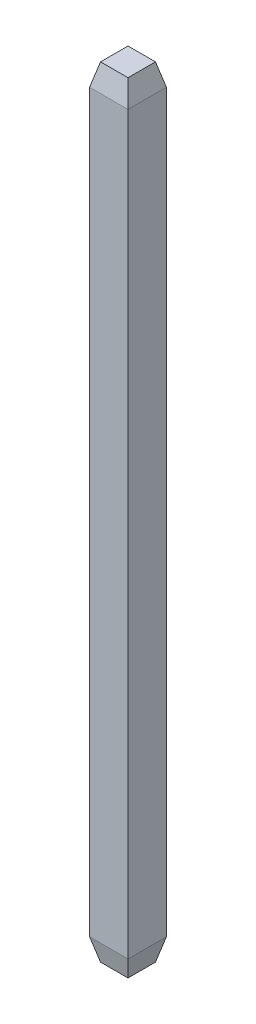
from build123d import *
from OCP.BRepFilletAPI import BRepFilletAPI_MakeChamfer

# Parameters (mm, degrees)
SKETCH_1_W      = 0.7
SKETCH_1_H      = 0.7
EXTRUDE_1_DEPTH = 14.2
CHAMFER_1_SIZE  = 0.4
CHAMFER_1_SIZE2 = 0.1
CHAMFER_2_SIZE  = 0.1
CHAMFER_2_SIZE2 = 0.4


with BuildPart() as part:
    # Эскиз1 → Бобышка-Вытянуть1 (new body)
    with BuildSketch(Plane(origin=(0, 0, 0), x_dir=(1, 0, 0), z_dir=(0, 1, 0))):
        Rectangle(SKETCH_1_W, SKETCH_1_H)
    extrude(amount=EXTRUDE_1_DEPTH)

    # Фаска1: one chamfer whose edges measure the first distance from different faces: ONE call of the kernel's chamfer builder (chamfer() names one face for all edges)
    chamfer_1_edges_1 = [part.edges().sort_by_distance(p)[0] for p in [
        (0, 14.2, -0.35),
    ]]
    chamfer_1_side_1 = [part.faces().sort_by_distance(p)[0] for p in [
        (0, 7.1, -0.35),
    ]]
    chamfer_1_edges_2 = [part.edges().sort_by_distance(p)[0] for p in [
        (-0.35, 14.2, 0),
    ]]
    chamfer_1_side_2 = [part.faces().sort_by_distance(p)[0] for p in [
        (-0.35, 7.1, 0),
    ]]
    chamfer_1_edges_3 = [part.edges().sort_by_distance(p)[0] for p in [
        (0, 14.2, 0.35),
    ]]
    chamfer_1_side_3 = [part.faces().sort_by_distance(p)[0] for p in [
        (0, 7.1, 0.35),
    ]]
    chamfer_1_edges_4 = [part.edges().sort_by_distance(p)[0] for p in [
        (0.35, 14.2, 0),
    ]]
    chamfer_1_side_4 = [part.faces().sort_by_distance(p)[0] for p in [
        (0.35, 7.1, 0),
    ]]
    chamfer_1 = BRepFilletAPI_MakeChamfer(part.part.solid().wrapped)
    for e in chamfer_1_edges_1:
        chamfer_1.Add(CHAMFER_1_SIZE, CHAMFER_1_SIZE2, e.wrapped, chamfer_1_side_1[0].wrapped)  # the first distance lies on this face
    for e in chamfer_1_edges_2:
        chamfer_1.Add(CHAMFER_1_SIZE, CHAMFER_1_SIZE2, e.wrapped, chamfer_1_side_2[0].wrapped)  # the first distance lies on this face
    for e in chamfer_1_edges_3:
        chamfer_1.Add(CHAMFER_1_SIZE, CHAMFER_1_SIZE2, e.wrapped, chamfer_1_side_3[0].wrapped)  # the first distance lies on this face
    for e in chamfer_1_edges_4:
        chamfer_1.Add(CHAMFER_1_SIZE, CHAMFER_1_SIZE2, e.wrapped, chamfer_1_side_4[0].wrapped)  # the first distance lies on this face
    add(Compound.cast(chamfer_1.Shape()), mode=Mode.REPLACE)

    # Фаска2
    chamfer_2_edges = [part.edges().sort_by_distance(p)[0] for p in [
        (0, 0, 0.35),
        (-0.35, 0, 0),
        (0, 0, -0.35),
        (0.35, 0, 0),
    ]]
    chamfer_2_side = [part.faces().sort_by_distance(p)[0] for p in [
        (0, 0, 0),
    ]]
    chamfer(chamfer_2_edges, length=CHAMFER_2_SIZE, length2=CHAMFER_2_SIZE2, reference=chamfer_2_side[0])


solid = part.part
